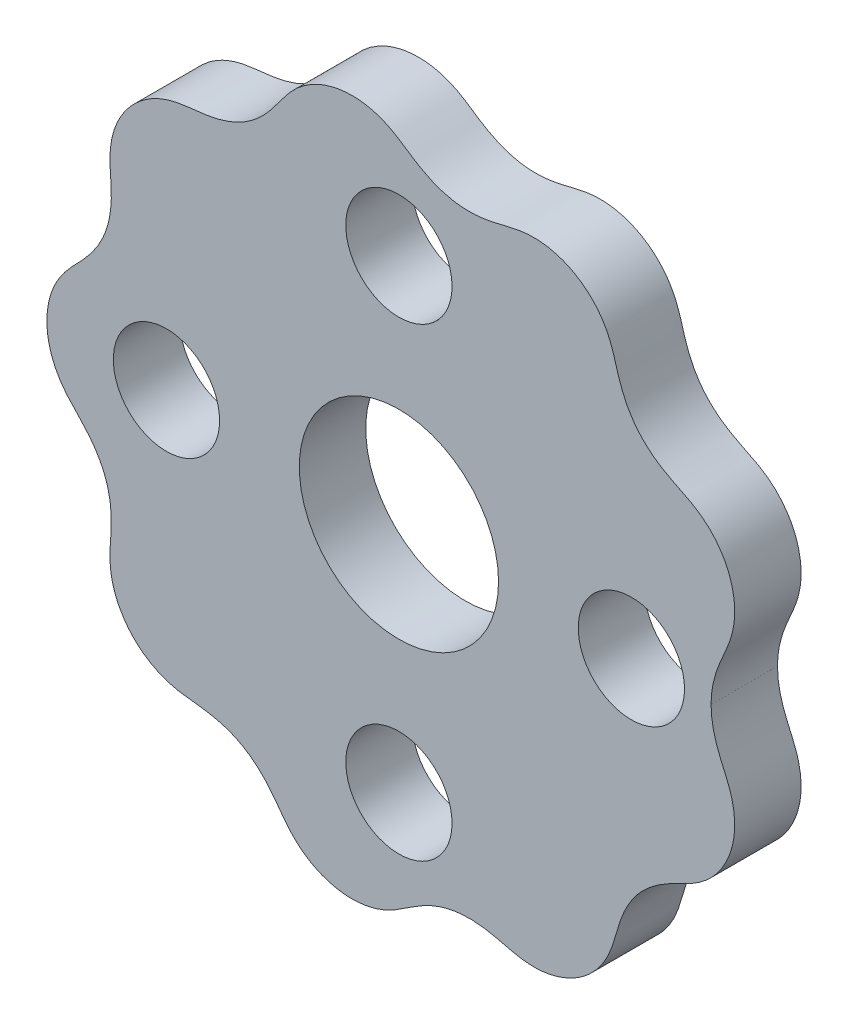
from build123d import *

# Parameters (mm, degrees)
BOSS_EXTRUDE2_DEPTH = 5
SKETCH5_R           = 7.5
CUT_EXTRUDE1_DEPTH  = 10
SKETCH6_R           = 4
CUT_EXTRUDE2_DEPTH  = 10


with BuildPart() as part:
    # Sketch4 → Boss-Extrude2 (new body)
    with BuildSketch(Plane.XY):
        with BuildLine():
            add(Edge.make_bspline(
                [(23.5, 0), (23.5, -0.02285766), (23.500277944, -0.068953251), (23.501528693, -0.147874512), (23.504862399, -0.264007237), (23.511108008, -0.404101212), (23.521918497, -0.56191341), (23.539337468, -0.747568026), (23.565757613, -0.960995007), (23.606788196, -1.225211381), (23.66855987, -1.54072422), (23.758160696, -1.904714429), (23.882685303, -2.314787574), (24.026632957, -2.718287623), (24.186359426, -3.115736339), (24.356850358, -3.508522598), (24.5316009, -3.899341749), (24.702328919, -4.291906352), (24.900195277, -4.789193939), (25.09760807, -5.401023628), (25.271697171, -6.248682723), (25.312008788, -7.336735156), (25.130039078, -8.523435658), (24.668018957, -9.748719488), (24.020623661, -10.762889008), (23.268582662, -11.558025755), (22.477396705, -12.154690262), (21.703688445, -12.591021296), (20.915388478, -12.963354349), (20.149884652, -13.351164881), (19.252976445, -13.900557169), (18.444614688, -14.566558582), (17.75090176, -15.361024858), (17.193330891, -16.259003455), (16.829832378, -17.033269246), (16.546873472, -17.835169749), (16.317332012, -18.648438475), (16.083119509, -19.456225004), (15.775910995, -20.236470556), (15.314772026, -21.070514949), (14.653080996, -21.910265418), (13.759682717, -22.689846842), (12.626089327, -23.325591376), (11.4828858, -23.684948397), (10.39569233, -23.810709236), (9.406076387, -23.759258243), (8.532907085, -23.596209652), (7.689700901, -23.374728024), (6.854015815, -23.179735798), (5.813807068, -23.024040169), (4.766469933, -23.014580915), (3.724375308, -23.177224476), (2.720028755, -23.506676687), (1.943870898, -23.866118602), (1.211647682, -24.298507311), (0.513043619, -24.773952676), (-0.185599795, -25.242216502), (-0.922450858, -25.642478495), (-1.811801626, -25.985019206), (-2.858457531, -26.203026547), (-4.043944654, -26.226008191), (-5.320986989, -25.984413555), (-6.42774251, -25.52490953), (-7.341446352, -24.922455297), (-8.066494491, -24.246960748), (-8.630600693, -23.560815248), (-9.134173134, -22.849150758), (-9.648992502, -22.162600216), (-10.345734132, -21.374675596), (-11.141933187, -20.694183304), (-12.044746804, -20.148893046), (-13.025873127, -19.755647771), (-13.851481773, -19.532061782), (-14.690327894, -19.392603222), (-15.531099397, -19.307751302), (-16.367286564, -19.217398055), (-17.189036719, -19.050410651), (-18.090513668, -18.741189099), (-19.032454168, -18.235458149), (-19.95539563, -17.491087859), (-20.778417347, -16.485185105), (-21.330925403, -15.421800632), (-21.643661255, -14.3729906), (-21.764924731, -13.389484812), (-21.756041186, -12.501264955), (-21.68435631, -11.632407315), (-21.637407646, -10.775561035), (-21.664641301, -9.724118612), (-21.837112358, -8.691038473), (-22.178160951, -7.692990627), (-22.676937264, -6.761071719), (-23.165646905, -6.059085934), (-23.718580274, -5.413038825), (-24.308099814, -4.807593604), (-24.890588977, -4.200899183), (-25.412774426, -3.544789874), (-25.904618785, -2.728476507), (-26.301154969, -1.73561465), (-26.529749148, -0.57214872), (-26.513696117, 0.727446372), (-26.253463888, 1.897203113), (-25.818917418, 2.90168106), (-25.279662156, 3.733061238), (-24.701943737, 4.407788471), (-24.08854256, 5.027298025), (-23.501795545, 5.653490296), (-22.846777965, 6.476426225), (-22.314812302, 7.378652091), (-21.934497614, 8.362407214), (-21.717515603, 9.396897146), (-21.64063046, 10.248783674), (-21.648907143, 11.099103818), (-21.71132249, 11.94183875), (-21.76757454, 12.781008883), (-21.745886265, 13.619272353), (-21.597987257, 14.56076266), (-21.263598848, 15.576242801), (-20.690897013, 16.614472579), (-19.843279708, 17.599739047), (-18.892057781, 18.32859325), (-17.91353225, 18.818791933), (-16.966050447, 19.109081863), (-16.089790282, 19.254634303), (-15.221684714, 19.33492494), (-14.369700277, 19.437445354), (-13.338948664, 19.646781004), (-12.351486815, 19.995946032), (-11.427782494, 20.505046696), (-10.596581513, 21.158005726), (-9.990079933, 21.761146376), (-9.449826369, 22.417834744), (-8.955931231, 23.103521314), (-8.459627225, 23.782529559), (-7.904213097, 24.410757328), (-7.185765921, 25.036945397), (-6.27689732, 25.599949222), (-5.170840037, 26.02720318), (-3.888219733, 26.237180011), (-2.691040651, 26.18413469), (-1.626341155, 25.930713437), (-0.713915615, 25.544099397), (0.050915097, 25.092376748), (0.767535839, 24.595879672), (1.486082878, 24.126755848), (2.4102264, 23.624533008), (3.391089735, 23.257242419), (4.42592343, 23.053448071), (5.482372926, 23.019316234), (6.334674507, 23.091466459), (7.170648642, 23.247227327), (7.989747975, 23.455014241), (8.806392816, 23.656161269), (9.635676186, 23.780431266), (10.588543636, 23.798353173), (11.646676225, 23.645478149), (12.768616034, 23.261863853), (13.886160094, 22.598312516), (14.76919189, 21.788185128), (15.42194342, 20.909707384), (15.872430779, 20.027067747), (16.167993782, 19.189413999), (16.397820409, 18.348441214), (16.64669582, 17.52719401), (17.031777298, 16.548429286), (17.547035724, 15.636562254), (18.208734594, 14.815241158), (18.996053752, 14.109991248), (19.695315811, 13.61738654), (20.435816592, 13.199332834), (21.196845977, 12.831988357), (21.951726572, 12.461164171), (22.66689989, 12.023331236), (23.408372005, 11.424609643), (24.12074125, 10.627366722), (24.732505338, 9.61423041), (25.161289787, 8.391897149), (25.317124778, 7.215018838), (25.263781673, 6.247903477), (25.117504076, 5.510438712), (24.966955871, 4.994206663), (24.822456983, 4.589058161), (24.679919053, 4.240845181), (24.529731713, 3.895937311), (24.398559868, 3.601385979), (24.270264787, 3.310090254), (24.127422447, 2.97103052), (23.994579701, 2.63234362), (23.859134168, 2.241640987), (23.742288174, 1.845016235), (23.646335, 1.442676635), (23.58211443, 1.086649555), (23.541901156, 0.779128174), (23.518511831, 0.520791518), (23.506141845, 0.327444733), (23.501337695, 0.143936874), (23.500143206, 0.057574077), (23.500022015, 0.016138392)],
                knots=[0.073048815, 0.073048815, 0.073048815, 0.073048815, 0.073048815, 0.073589664, 0.074130513, 0.074671362, 0.075212211, 0.076293909, 0.077375608, 0.078457306, 0.079539004, 0.0817024, 0.083865796, 0.086029193, 0.088192589, 0.090355985, 0.092518132, 0.094680279, 0.096842426, 0.099004573, 0.103328867, 0.107653161, 0.114269271, 0.120885382, 0.127404675, 0.133923969, 0.138401533, 0.142879097, 0.147356661, 0.151834225, 0.156020279, 0.160206333, 0.168578442, 0.172889823, 0.177201205, 0.181512586, 0.185823968, 0.190049494, 0.19427502, 0.198500545, 0.202726071, 0.209245206, 0.215764341, 0.222283635, 0.228802928, 0.233280494, 0.23775806, 0.242235626, 0.246713191, 0.250899243, 0.255085295, 0.263457398, 0.267768781, 0.272080164, 0.276391547, 0.28070293, 0.284928455, 0.28915398, 0.293379505, 0.29760503, 0.304124165, 0.3106433, 0.317162594, 0.323681887, 0.328159455, 0.332637023, 0.337114591, 0.341592158, 0.345778207, 0.349964257, 0.358336355, 0.362647739, 0.366959124, 0.371270508, 0.375581892, 0.379807416, 0.38403294, 0.388258464, 0.392483989, 0.399003124, 0.40552226, 0.412041553, 0.418560846, 0.423038416, 0.427515986, 0.431993555, 0.436471125, 0.440657172, 0.444843218, 0.453215312, 0.457526697, 0.461838083, 0.466149468, 0.470460854, 0.474686377, 0.478911901, 0.483137424, 0.487362947, 0.493882083, 0.500401219, 0.506920512, 0.513439805, 0.517917377, 0.522394948, 0.52687252, 0.531350092, 0.535536136, 0.53972218, 0.548094268, 0.552405655, 0.556717042, 0.561028429, 0.565339816, 0.569565338, 0.573790861, 0.578016384, 0.582241906, 0.588761042, 0.595280178, 0.601799471, 0.608318764, 0.612796338, 0.617273911, 0.621751485, 0.626229059, 0.6304151, 0.634601142, 0.642973225, 0.647284613, 0.651596001, 0.65590739, 0.660218778, 0.6644443, 0.668669821, 0.672895343, 0.677120865, 0.683640001, 0.690159138, 0.69667843, 0.703197723, 0.707675299, 0.712152874, 0.71663045, 0.721108026, 0.725294065, 0.729480104, 0.737852182, 0.742163571, 0.746474961, 0.75078635, 0.75509774, 0.759323261, 0.763548782, 0.767774303, 0.771999824, 0.77851896, 0.785038097, 0.791557389, 0.798076682, 0.802554259, 0.807031837, 0.811509415, 0.815986992, 0.820173029, 0.824359065, 0.832731138, 0.837042529, 0.84135392, 0.845665311, 0.849976702, 0.854202222, 0.858427742, 0.862653262, 0.866878782, 0.873397919, 0.879917057, 0.886392972, 0.892868888, 0.897212043, 0.89938362, 0.901555198, 0.903726775, 0.905898352, 0.906984141, 0.909155718, 0.910241507, 0.912329355, 0.914417202, 0.91650505, 0.918592897, 0.920680745, 0.922768592, 0.923812516, 0.92485644, 0.925900364, 0.926881315, 0.926881315, 0.926881315, 0.926881315, 0.926881315], degree=4))
            add(Edge.make_bspline(
                [(23.5, 0), (23.499999729, 0.00275), (23.5000022, 0.005499996)],
                knots=[0, 0, 0, 0.340801635, 0.340801635, 0.340801635], degree=2))
            add(Edge.make_bspline(
                [(23.500022015, 0.016138392), (23.500014235, 0.01347841), (23.50000834, 0.010820088), (23.500004329, 0.008161377), (23.5000022, 0.005499996)],
                knots=[0.926881315, 0.926881315, 0.926881315, 0.926881315, 0.926881315, 0.926944288, 0.926944288, 0.926944288, 0.926944288, 0.926944288], degree=4))
        make_face()
    extrude(amount=BOSS_EXTRUDE2_DEPTH)

    # Sketch5 → Cut-Extrude1 (cut)
    with BuildSketch(Plane.XY.offset(5)):
        Circle(SKETCH5_R)
    extrude(amount=-CUT_EXTRUDE1_DEPTH, mode=Mode.SUBTRACT)

    # Sketch6 → Cut-Extrude2 (cut)
    with BuildSketch(Plane.XY.offset(5)):
        with Locations((0, 17.5)):
            Circle(SKETCH6_R)
        with Locations((17.5, 0)):
            Circle(SKETCH6_R)
        with Locations((0, -17.5)):
            Circle(SKETCH6_R)
        with Locations((-17.5, 0)):
            Circle(SKETCH6_R)
    extrude(amount=-CUT_EXTRUDE2_DEPTH, mode=Mode.SUBTRACT)


solid = part.part
